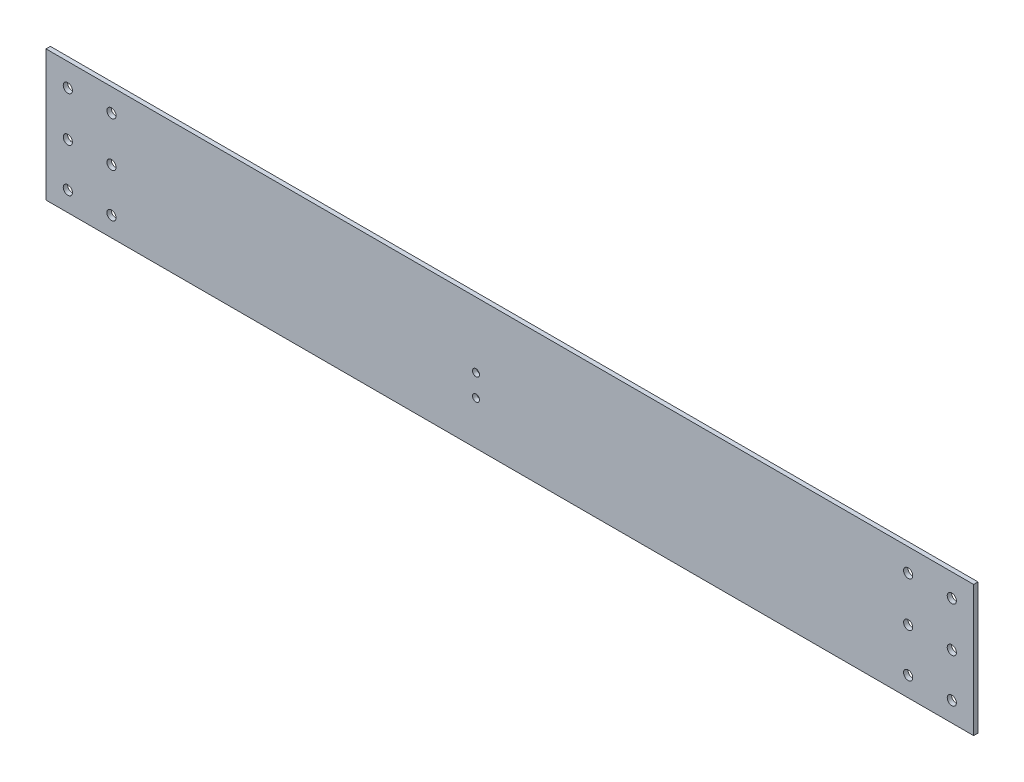
from build123d import *

# Parameters (mm, degrees)
SKETCH_1_W          = 425
SKETCH_1_H          = 60
EXTRUDE_1_DEPTH     = 2
SKETCH_2_R          = 2.1
SKETCH_2_R_2        = 1.6
CUT_EXTRUDE_1_DEPTH = 215.61651847


with BuildPart() as part:
    # 草图1 → 凸台-拉伸1 (new body)
    with BuildSketch(Plane.XY):
        Rectangle(SKETCH_1_W, SKETCH_1_H)
    extrude(amount=EXTRUDE_1_DEPTH)

    # 草图2 → 切除-拉伸1 (cut, through all)
    with BuildSketch(Plane(origin=(0, 0, 0), x_dir=(-1, 0, 0), z_dir=(0, 0, -1))):
        with Locations((202.5, -21)):
            Circle(SKETCH_2_R)
        with Locations((182.5, -21)):
            Circle(SKETCH_2_R)
        with Locations((202.5, 19.5)):
            Circle(SKETCH_2_R)
        with Locations((202.5, -1)):
            Circle(SKETCH_2_R)
        with Locations((182.5, -1)):
            Circle(SKETCH_2_R)
        with Locations((182.5, 19.5)):
            Circle(SKETCH_2_R)
        with Locations((-182.5, -21)):
            Circle(SKETCH_2_R)
        with Locations((-202.5, -21)):
            Circle(SKETCH_2_R)
        with Locations((-182.5, -1)):
            Circle(SKETCH_2_R)
        with Locations((-202.5, -1)):
            Circle(SKETCH_2_R)
        with Locations((-202.5, 19.5)):
            Circle(SKETCH_2_R)
        with Locations((-182.5, 19.5)):
            Circle(SKETCH_2_R)
        with Locations((15.5, -10)):
            Circle(SKETCH_2_R_2)
        with Locations((15.5, 0)):
            Circle(SKETCH_2_R_2)
    extrude(amount=-CUT_EXTRUDE_1_DEPTH, mode=Mode.SUBTRACT)


solid = part.part
